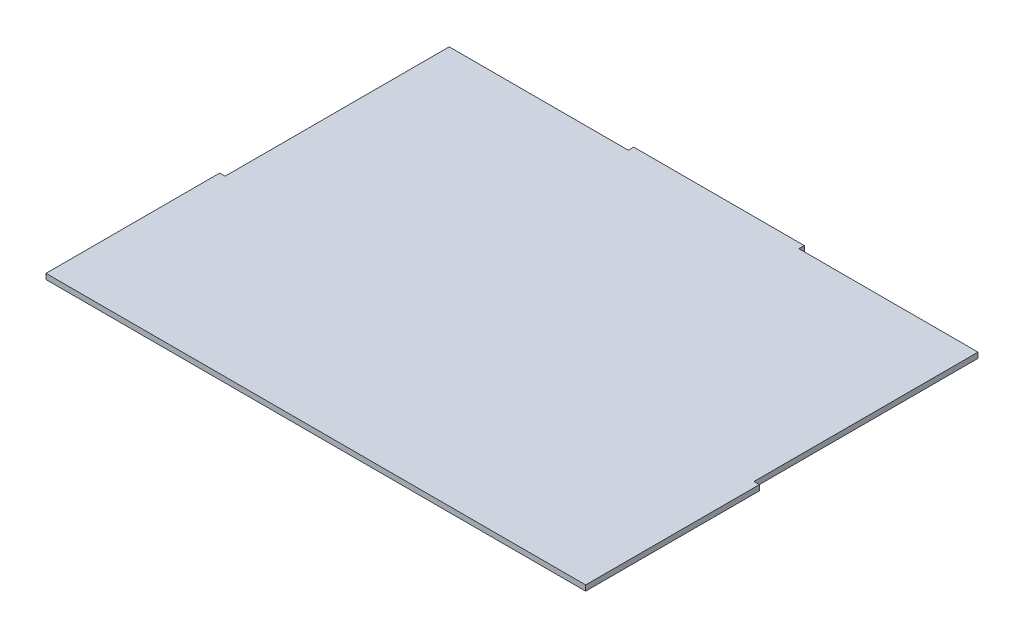
from build123d import *

# Parameters (mm, degrees)
SKETCH1_W           = 315.58
SKETCH1_H           = 3.175
BOSS_EXTRUDE1_DEPTH = 232.600000128
SKETCH5_W           = 3.175
SKETCH5_H           = 130.999992
CUT_EXTRUDE2_DEPTH  = 282.088108579
SKETCH10_W          = 99.68
SKETCH10_H          = 3.175
BOSS_EXTRUDE2_DEPTH = 3.175


with BuildPart() as part:
    # Sketch1 → Boss-Extrude1 (new body)
    with BuildSketch(Plane.XY):
        Rectangle(SKETCH1_W, SKETCH1_H)
    extrude(amount=BOSS_EXTRUDE1_DEPTH)

    # Sketch5 → Cut-Extrude2 (cut, symmetric)
    with BuildSketch(Plane(origin=(0, 1.5875, 0), x_dir=(1, 0, 0), z_dir=(0, 1, 0))):
        with Locations((-156.2025, -65.499996)):
            Rectangle(SKETCH5_W, SKETCH5_H)
    cut_extrude2 = extrude(amount=CUT_EXTRUDE2_DEPTH, both=True, mode=Mode.SUBTRACT)

    # Mirror1: Cut-Extrude2 across plane
    add(cut_extrude2.mirror(Plane(origin=(0, 0, 0), x_dir=(0, 0, 1), z_dir=(1, 0, 0))), mode=Mode.SUBTRACT)

    # Sketch10 → Boss-Extrude2 (add)
    with BuildSketch(Plane(origin=(0, 0, 0), x_dir=(-1, 0, 0), z_dir=(0, 0, -1))):
        Rectangle(SKETCH10_W, SKETCH10_H)
    extrude(amount=BOSS_EXTRUDE2_DEPTH)


solid = part.part
